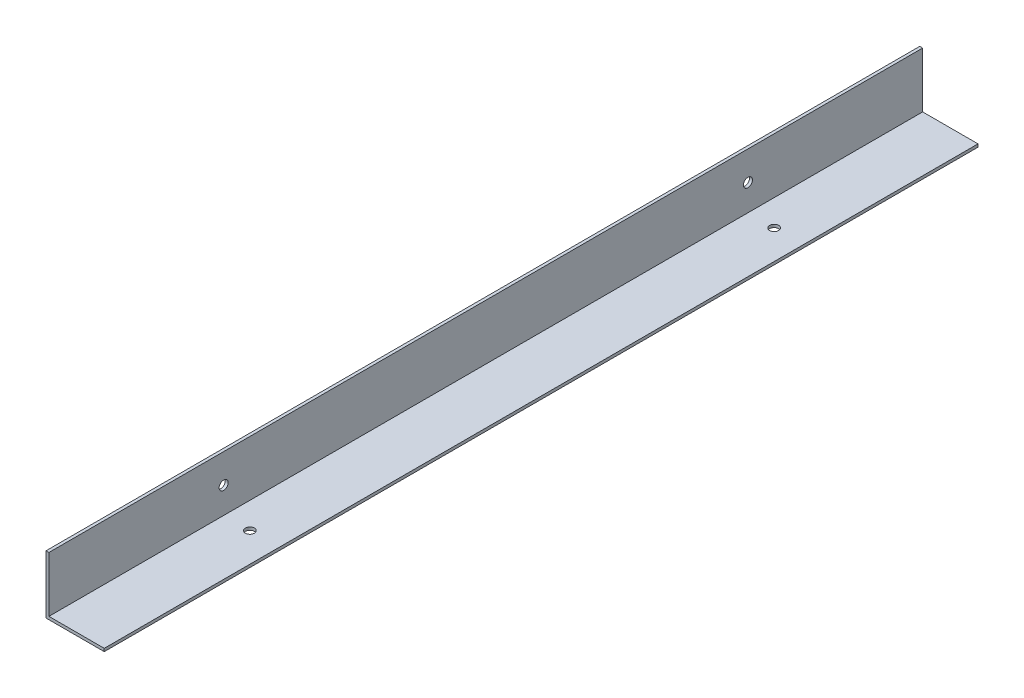
from build123d import *

# Parameters (mm, degrees)
BOSS_EXTRUDE1_DEPTH          = 476.25
F_10_0_1935_DIAMETER_HOLE1_D = 4.9149
F_10_0_1935_DIAMETER_HOLE2_D = 4.9149


with BuildPart() as part:
    # Sketch2 → Boss-Extrude1 (new body)
    with BuildSketch(Plane.XY):
        Polygon((0, 0), (0, 31.75), (1.5875, 31.75), (1.5875, 1.5875), (31.75, 1.5875), (31.75, 0), align=None)
    extrude(amount=BOSS_EXTRUDE1_DEPTH)

    # #10 (0.1935) Diameter Hole1 (through all)
    with Locations(Plane.ZY):
        with Locations((95.25, 15.875), (381, 15.875)):
            Hole(F_10_0_1935_DIAMETER_HOLE1_D / 2)

    # #10 (0.1935) Diameter Hole2 (through all)
    with Locations(Plane(origin=(0, 0, 0), x_dir=(-1, 0, 0), z_dir=(0, -1, 0))):
        with Locations((-15.875, -95.25), (-15.875, -381)):
            Hole(F_10_0_1935_DIAMETER_HOLE2_D / 2)


solid = part.part
